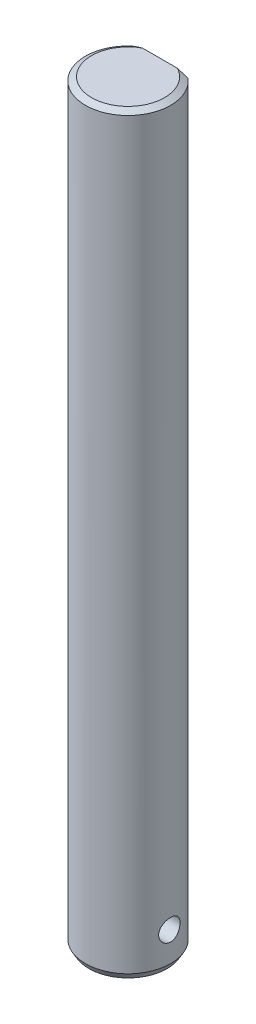
from build123d import *
from OCP.BRepFilletAPI import BRepFilletAPI_MakeChamfer

# Parameters (mm, degrees)
SKETCH1_R           = 6
BOSS_EXTRUDE1_DEPTH = 106
SKETCH2_W           = 31.439241669
SKETCH2_H           = 10.216105784
CUT_EXTRUDE1_DEPTH  = 10
SKETCH4_R           = 1.5
CUT_EXTRUDE2_DEPTH  = 25
CHAMFER1_SIZE       = 0.5
CHAMFER1_SIZE2      = 0.866025404


with BuildPart() as part:
    # Sketch1 → Boss-Extrude1 (new body)
    with BuildSketch(Plane(origin=(0, 0, 0), x_dir=(1, 0, 0), z_dir=(0, 1, 0))):
        with Locations(Location((0, 0, 0), (0, 0, 270))):
            Circle(SKETCH1_R)
    extrude(amount=BOSS_EXTRUDE1_DEPTH)

    # Sketch2 → Cut-Extrude1 (cut)
    with BuildSketch(Plane(origin=(0, 106, 0), x_dir=(1, 0, 0), z_dir=(0, 1, 0))):
        with Locations((-1.979627098, 9.608052892)):
            Rectangle(SKETCH2_W, SKETCH2_H)
    extrude(amount=-CUT_EXTRUDE1_DEPTH, mode=Mode.SUBTRACT)

    # Sketch4 → Cut-Extrude2 (cut, symmetric)
    with BuildSketch(Plane(origin=(0, 0, 0), x_dir=(0, 0, -1), z_dir=(1, 0, 0))):
        with Locations((0, 5)):
            Circle(SKETCH4_R)
    extrude(amount=CUT_EXTRUDE2_DEPTH, both=True, mode=Mode.SUBTRACT)

    # Chamfer1: one chamfer whose edges measure the first distance from different faces: ONE call of the kernel's chamfer builder (chamfer() names one face for all edges)
    chamfer1_edges_1 = [part.edges().sort_by_distance(p)[0] for p in [
        (0, 0, -6),
    ]]
    chamfer1_side_1 = [part.faces().sort_by_distance(p)[0] for p in [
        (0, 0, 0),
    ]]
    chamfer1_edges_2 = [part.edges().sort_by_distance(p)[0] for p in [
        (-5.61248608, 106, 2.121320344),
    ]]
    chamfer1_side_2 = [part.faces().sort_by_distance(p)[0] for p in [
        (0, 53, -6),
    ]]
    chamfer1 = BRepFilletAPI_MakeChamfer(part.part.solid().wrapped)
    for e in chamfer1_edges_1:
        chamfer1.Add(CHAMFER1_SIZE, CHAMFER1_SIZE2, e.wrapped, chamfer1_side_1[0].wrapped)  # the first distance lies on this face
    for e in chamfer1_edges_2:
        chamfer1.Add(CHAMFER1_SIZE, CHAMFER1_SIZE2, e.wrapped, chamfer1_side_2[0].wrapped)  # the first distance lies on this face
    add(Compound.cast(chamfer1.Shape()), mode=Mode.REPLACE)


solid = part.part
